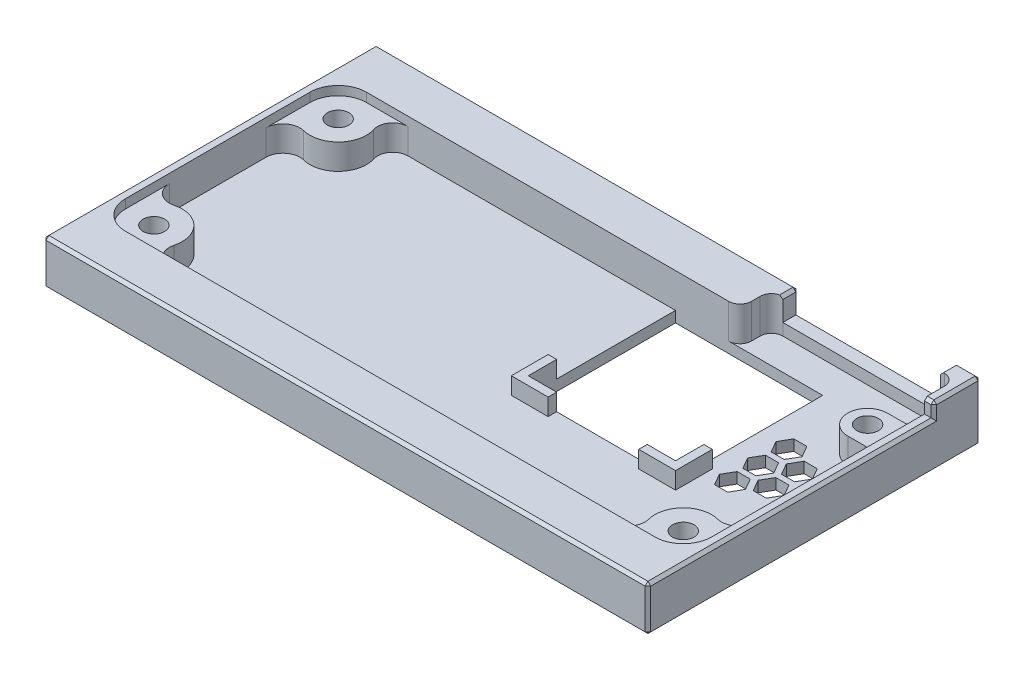
from build123d import *

# Parameters (mm, degrees)
SKETCH_1_W          = 106.8
SKETCH_1_H          = 58.8
EXTRUDE_1_DEPTH     = 8
CUT_EXTRUDE_1_DEPTH = 6.08
EXTRUDE_START       = 2.5
EXTRUDE_2_DEPTH     = 2.5
SKETCH_4_W          = 27.87
SKETCH_4_H          = 2.8
CUT_EXTRUDE_2_DEPTH = 4
EXTRUDE_START_2     = 4.5
EXTRUDE_3_DEPTH     = 4.5
SKETCH_6_R          = 1.9
CUT_EXTRUDE_3_DEPTH = 38.5
SKETCH_7_R          = 3.25
CUT_EXTRUDE_4_DEPTH = 3
CHAMFER_7_SIZE      = 0.5
CUT_EXTRUDE_5_DEPTH = 3
CHAMFER_6_SIZE      = 0.5
EXTRUDE_4_DEPTH     = 3
CUT_EXTRUDE_6_DEPTH = 3


with BuildPart() as part:
    # 草图1 → 凸台-拉伸1 (new body)
    with BuildSketch(Plane(origin=(0, 0, 0), x_dir=(1, 0, 0), z_dir=(0, 1, 0))):
        Rectangle(SKETCH_1_W, SKETCH_1_H)
    extrude(amount=EXTRUDE_1_DEPTH)

    # 草图2 → 切除-拉伸1 (cut)
    with BuildSketch(Plane(origin=(0, 8, 0), x_dir=(1, 0, 0), z_dir=(0, 1, 0))):
        with BuildLine():
            Line((-46.75, -21.5), (46.75, -21.5))
            ThreePointArc((46.75, -21.5), (50.285533906, -20.035533906), (51.75, -16.5))
            Line((51.75, -16.5), (51.75, 24.6))
            ThreePointArc((51.75, 24.6), (51.164213562, 26.014213562), (49.75, 26.6))
            Line((49.75, 26.6), (21.23, 26.6))
            ThreePointArc((21.23, 26.6), (19.815786438, 26.014213562), (19.23, 24.6))
            Line((19.23, 24.6), (19.23, 23.05))
            ThreePointArc((19.23, 23.05), (18.644213562, 21.635786438), (17.23, 21.05))
            Line((17.23, 21.05), (-46.75, 21.05))
            ThreePointArc((-46.75, 21.05), (-50.285533906, 19.585533906), (-51.75, 16.05))
            Line((-51.75, 16.05), (-51.75, -16.5))
            ThreePointArc((-51.75, -16.5), (-50.285533906, -20.035533906), (-46.75, -21.5))
        make_face()
    extrude(amount=-CUT_EXTRUDE_1_DEPTH, mode=Mode.SUBTRACT)

    # 草图3 → 凸台-拉伸2 (add)
    with BuildSketch(Plane(origin=(0, 8, 0), x_dir=(1, 0, 0), z_dir=(0, 1, 0)).offset(EXTRUDE_START)):
        with BuildLine():
            Line((51.75, 21.1), (53.4, 21.1))
            Line((53.4, 21.1), (53.4, 29.4))
            Line((53.4, 29.4), (49.1, 29.4))
            Line((49.1, 29.4), (49.1, 26.6))
            Line((49.1, 26.6), (49.75, 26.6))
            ThreePointArc((49.75, 26.6), (51.164213562, 26.014213562), (51.75, 24.6))
            Line((51.75, 24.6), (51.75, 21.1))
        make_face()
    extrude(amount=-EXTRUDE_2_DEPTH)

    # 草图4 → 切除-拉伸2 (cut)
    with BuildSketch(Plane(origin=(0, 8, 0), x_dir=(1, 0, 0), z_dir=(0, 1, 0))):
        with Locations((35.165, 28)):
            Rectangle(SKETCH_4_W, SKETCH_4_H)
    extrude(amount=-CUT_EXTRUDE_2_DEPTH, mode=Mode.SUBTRACT)

    # 草图5 → 凸台-拉伸3 (add)
    with BuildSketch(Plane(origin=(0, 1.92, 0), x_dir=(1, 0, 0), z_dir=(0, 1, 0)).offset(EXTRUDE_START_2)):
        with BuildLine():
            Line((49.75, 19.55), (46.75, 19.55))
            ThreePointArc((46.75, 19.55), (43.25, 16.05), (46.75, 12.55))
            Line((46.75, 12.55), (49.75, 12.55))
            ThreePointArc((49.75, 12.55), (51.164213562, 11.964213562), (51.75, 10.55))
            Line((51.75, 10.55), (51.75, 21.55))
            ThreePointArc((51.75, 21.55), (51.164213562, 20.135786438), (49.75, 19.55))
        make_face()
        with BuildLine():
            Line((51.75, -16.5), (51.75, -8.754033308))
            ThreePointArc((51.75, -8.754033308), (50.587117307, -11.125741553), (48, -11.658770817))
            ThreePointArc((48, -11.658770817), (43.214466094, -12.964466094), (41.908770817, -17.75))
            ThreePointArc((41.908770817, -17.75), (41.375741553, -20.337117307), (39.004033308, -21.5))
            Line((39.004033308, -21.5), (46.75, -21.5))
            ThreePointArc((46.75, -21.5), (50.285533906, -20.035533906), (51.75, -16.5))
        make_face()
        with BuildLine():
            Line((-46.75, -21.5), (-39.004033308, -21.5))
            ThreePointArc((-39.004033308, -21.5), (-41.375741553, -20.337117307), (-41.908770817, -17.75))
            ThreePointArc((-41.908770817, -17.75), (-43.214466094, -12.964466094), (-48, -11.658770817))
            ThreePointArc((-48, -11.658770817), (-50.587117307, -11.125741553), (-51.75, -8.754033308))
            Line((-51.75, -8.754033308), (-51.75, -16.5))
            ThreePointArc((-51.75, -16.5), (-50.285533906, -20.035533906), (-46.75, -21.5))
        make_face()
        with BuildLine():
            ThreePointArc((-41.983146282, 17.55900816), (-41.590050849, 19.952787734), (-39.42652828, 21.05))
            Line((-39.42652828, 21.05), (-46.75, 21.05))
            ThreePointArc((-46.75, 21.05), (-50.285533906, 19.585533906), (-51.75, 16.05))
            Line((-51.75, 16.05), (-51.75, 8.304033308))
            ThreePointArc((-51.75, 8.304033308), (-50.587117307, 10.675741553), (-48, 11.208770817))
            ThreePointArc((-48, 11.208770817), (-43.12047612, 12.611023931), (-41.983146282, 17.55900816))
        make_face()
    extrude(amount=-EXTRUDE_3_DEPTH)

    # 草图6 → 切除-拉伸3 (cut)
    with BuildSketch(Plane(origin=(0, 6.42, 0), x_dir=(1, 0, 0), z_dir=(0, 1, 0))):
        with Locations((-46.75, 16.05)):
            Circle(SKETCH_6_R)
        with Locations((-46.75, -16.5)):
            Circle(SKETCH_6_R)
        with Locations((46.75, -16.5)):
            Circle(SKETCH_6_R)
        with Locations((46.75, 16.05)):
            Circle(SKETCH_6_R)
    extrude(amount=-CUT_EXTRUDE_3_DEPTH, mode=Mode.SUBTRACT)

    # 草图7 → 切除-拉伸4 (cut)
    with BuildSketch(Plane.XZ):
        with Locations((-46.75, 16.5)):
            Circle(SKETCH_7_R)
        with Locations((46.75, 16.5)):
            Circle(SKETCH_7_R)
        with Locations((46.75, -16.05)):
            Circle(SKETCH_7_R)
        with Locations((-46.75, -16.05)):
            Circle(SKETCH_7_R)
    extrude(amount=-CUT_EXTRUDE_4_DEPTH, mode=Mode.SUBTRACT)

    # 倒角7
    chamfer_7_edges = [part.edges().sort_by_distance(p)[0] for p in [
        (-50, 0, -16.05),
        (-50, 0, 16.5),
        (43.5, 0, -16.05),
        (43.5, 0, 16.5),
    ]]
    chamfer(chamfer_7_edges, length=CHAMFER_7_SIZE)

    # 草图8 → 切除-拉伸5 (cut)
    with BuildSketch(Plane(origin=(0, 1.92, 0), x_dir=(1, 0, 0), z_dir=(0, 1, 0))):
        Polygon((17.23, 21.05), (7.83, 21.05), (7.83, -4.95), (33.83, -4.95), (33.83, 21.05), align=None)
    extrude(amount=-CUT_EXTRUDE_5_DEPTH, mode=Mode.SUBTRACT)

    # 倒角6
    chamfer_6_edges = [part.edges().sort_by_distance(p)[0] for p in [
        (53.4, 4, 29.4),
        (53.4, 8, 4.15),
        (53.4, 9.25, -21.1),
        (52.575, 10.5, -21.1),
        (49.1, 10.5, -28),
        (21.23, 8, -28),
        (21.23, 6, -29.4),
        (35.165, 4, -29.4),
        (49.1, 7.25, -29.4),
        (51.25, 10.5, -29.4),
        (53.4, 10.5, -25.25),
        (-16.085, 8, -29.4),
        (-53.4, 8, 0),
        (0, 8, 29.4),
        (-53.4, 4, 29.4),
        (0, 0, 29.4),
        (-53.4, 0, 0),
        (-53.4, 4, -29.4),
        (53.4, 0, 0),
        (53.4, 5.25, -29.4),
        (0, 0, -29.4),
    ]]
    chamfer(chamfer_6_edges, length=CHAMFER_6_SIZE)

    # 草图11 → 凸台-拉伸4 (add)
    with BuildSketch(Plane(origin=(0, 1.92, 0), x_dir=(1, 0, 0), z_dir=(0, 1, 0))):
        Polygon((35.33, -6.45), (35.33, 0.05), (33.83, 0.05), (33.83, -4.95), (28.83, -4.95), (28.83, -6.45), align=None)
        Polygon((6.33, 0.05), (6.33, -6.45), (12.83, -6.45), (12.83, -4.95), (7.83, -4.95), (7.83, 0.05), align=None)
    extrude(amount=EXTRUDE_4_DEPTH)

    # 草图12 → 切除-拉伸6 (cut)
    with BuildSketch(Plane(origin=(0, 1.92, 0), x_dir=(1, 0, 0), z_dir=(0, 1, 0))):
        Polygon((36.768275427, 9.845748795), (37.922975965, 7.845748795), (40.232377042, 7.845748795), (41.38707758, 9.845748795), (40.232377042, 11.845748795), (37.922975965, 11.845748795), align=None)
        Polygon((41.098402446, 7.345748795), (42.253102984, 5.345748795), (44.562504061, 5.345748795), (45.717204599, 7.345748795), (44.562504061, 9.345748795), (42.253102984, 9.345748795), align=None)
        Polygon((42.253102984, 4.345748795), (41.098402446, 2.345748795), (42.253102984, 0.345748795), (44.562504061, 0.345748795), (45.717204599, 2.345748795), (44.562504061, 4.345748795), align=None)
        Polygon((37.922975965, 2.845748795), (40.232377042, 2.845748795), (41.38707758, 4.845748795), (40.232377042, 6.845748795), (37.922975965, 6.845748795), (36.768275427, 4.845748795), align=None)
        Polygon((41.38707758, -0.154251205), (40.232377042, 1.845748795), (37.922975965, 1.845748795), (36.768275427, -0.154251205), (37.922975965, -2.154251205), (40.232377042, -2.154251205), align=None)
    extrude(amount=-CUT_EXTRUDE_6_DEPTH, mode=Mode.SUBTRACT)


solid = part.part
